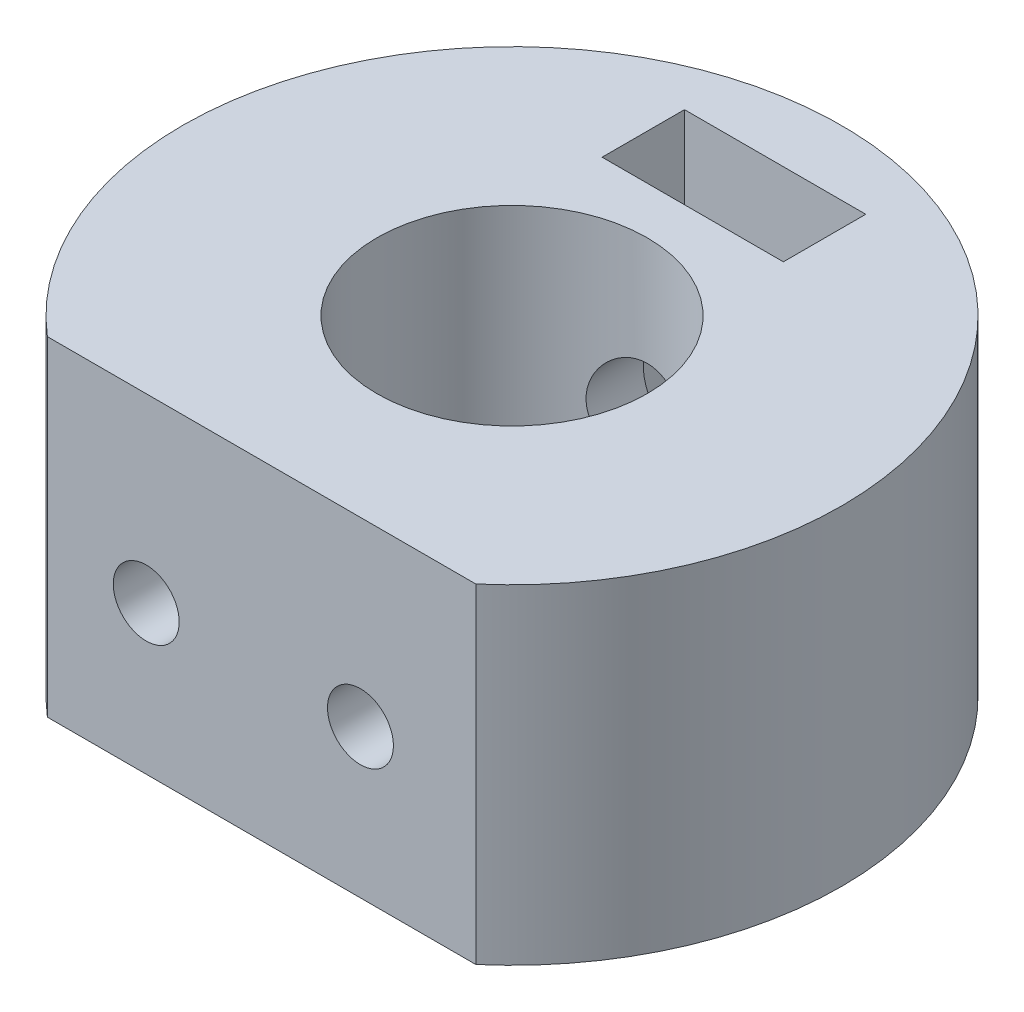
from build123d import *

# Parameters (mm, degrees)
SKETCH_1_R          = 10
SKETCH_1_R_2        = 4.1
EXTRUDE_1_DEPTH     = 10
CUT_EXTRUDE_1_DEPTH = 18.320508076
SKETCH_3_R          = 1
CUT_EXTRUDE_2_DEPTH = 7
SKETCH_4_R          = 1.55
CUT_EXTRUDE_3_DEPTH = 11
SKETCH_5_W          = 5.5
SKETCH_5_H          = 2.5
CUT_EXTRUDE_4_DEPTH = 8


with BuildPart() as part:
    # 草图1 → 凸台-拉伸1 (new body)
    with BuildSketch(Plane(origin=(0, 0, 0), x_dir=(1, 0, 0), z_dir=(0, 1, 0))):
        with Locations(Location((0, 0, 0), (0, 0, 270))):
            Circle(SKETCH_1_R)
        with Locations(Location((0, 0, 0), (0, 0, 270))):
            Circle(SKETCH_1_R_2, mode=Mode.SUBTRACT)
    extrude(amount=EXTRUDE_1_DEPTH)

    # 草图2 → 切除-拉伸1 (cut, through all)
    with BuildSketch(Plane(origin=(0, 10, 0), x_dir=(1, 0, 0), z_dir=(0, 1, 0))):
        with BuildLine():
            Line((-6.5, -7.599342077), (6.5, -7.599342077))
            ThreePointArc((6.5, -7.599342077), (0, -10), (-6.5, -7.599342077))
        make_face()
    extrude(amount=-CUT_EXTRUDE_1_DEPTH, mode=Mode.SUBTRACT)

    # 草图3 → 切除-拉伸2 (cut)
    with BuildSketch(Plane.XY.offset(7.599342077)):
        with Locations((-3.5, 4.5)):
            Circle(SKETCH_3_R)
        with Locations((3, 4.5)):
            Circle(SKETCH_3_R)
    extrude(amount=-CUT_EXTRUDE_2_DEPTH, mode=Mode.SUBTRACT)

    # 草图4 → 切除-拉伸3 (cut)
    with BuildSketch(Plane.XY.offset(-2.400657923)):
        with Locations((0, 5.148756005)):
            Circle(SKETCH_4_R)
    extrude(amount=-CUT_EXTRUDE_3_DEPTH, mode=Mode.SUBTRACT)

    # 草图5 → 切除-拉伸4 (cut)
    with BuildSketch(Plane(origin=(0, 10, 0), x_dir=(1, 0, 0), z_dir=(0, 1, 0))):
        with Locations((-0.049141686, 6.782816016)):
            Rectangle(SKETCH_5_W, SKETCH_5_H)
    extrude(amount=-CUT_EXTRUDE_4_DEPTH, mode=Mode.SUBTRACT)


solid = part.part
